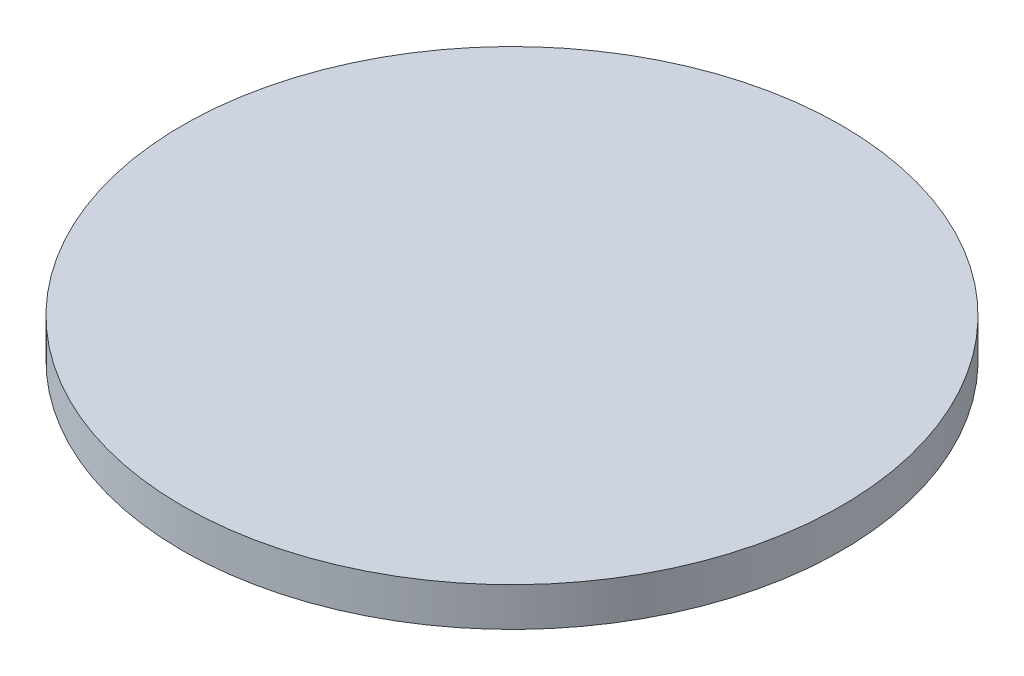
from build123d import *

# Parameters (mm, degrees)
CROQUIS2_R     = 85
EXTRUIR2_DEPTH = 10


with BuildPart() as part:
    # Croquis2 → Extruir2 (new body)
    with BuildSketch(Plane(origin=(0, 0, 0), x_dir=(1, 0, 0), z_dir=(0, 1, 0))):
        with Locations(Location((0, 0, 0), (0, 0, 270))):
            Circle(CROQUIS2_R)
    extrude(amount=EXTRUIR2_DEPTH)


solid = part.part
